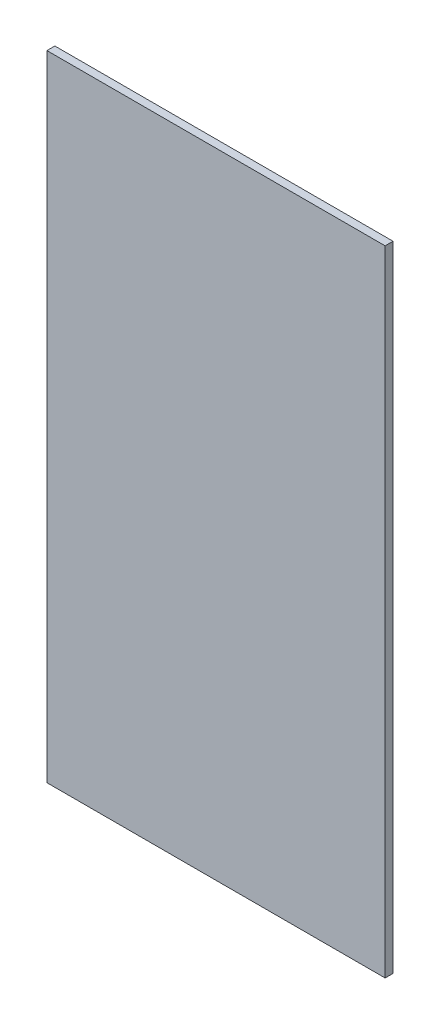
from build123d import *

# Parameters (mm, degrees)
SKETCH1_W           = 812.8
SKETCH1_H           = 1524
BOSS_EXTRUDE1_DEPTH = 19.05


with BuildPart() as part:
    # Sketch1 → Boss-Extrude1 (new body)
    with BuildSketch(Plane.XY):
        with Locations((2386.632015734, 1180.940513025)):
            Rectangle(SKETCH1_W, SKETCH1_H)
    extrude(amount=BOSS_EXTRUDE1_DEPTH)


solid = part.part
